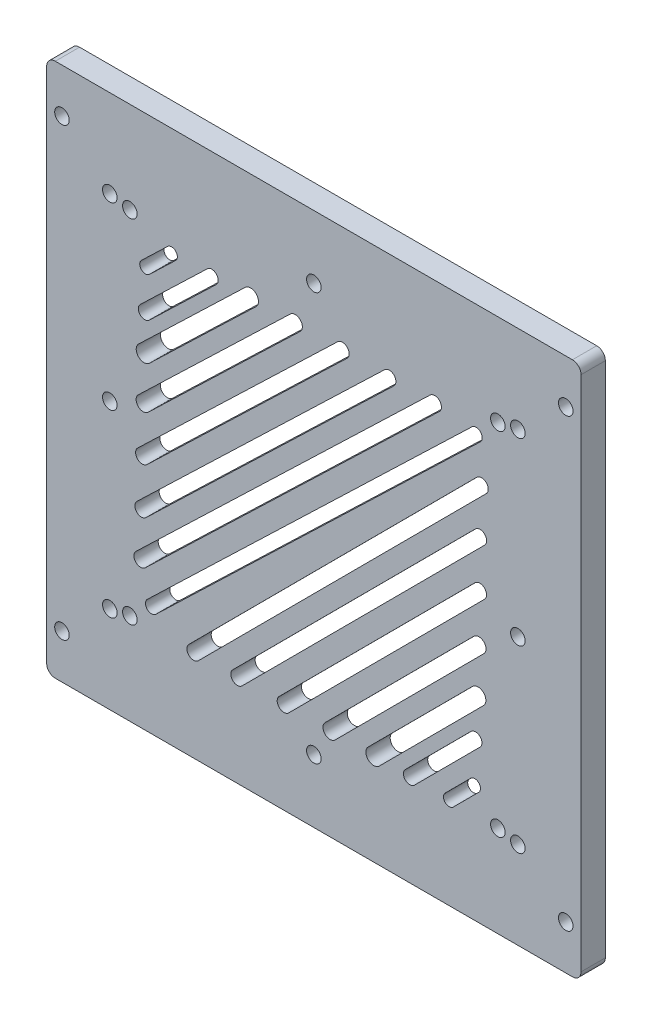
from build123d import *

# Parameters (mm, degrees)
BOSS_EXTRUDE1_DEPTH = 5
SKETCH1_3_R         = 1.5
CUT_EXTRUDE1_DEPTH  = 5
BOSS_EXTRUDE2_DEPTH = 1.5
SKETCH3_R           = 1.5
CUT_EXTRUDE3_DEPTH  = 10
CUT_EXTRUDE4_DEPTH  = 5


with BuildPart() as part:
    # Sketch1 → Boss-Extrude1 (new body)
    with BuildSketch(Plane.XY):
        with BuildLine():
            Line((1.77549062, 0), (108.22450938, 0))
            ThreePointArc((108.22450938, 0), (109.479970837, 0.520029163), (110, 1.77549062))
            Line((110, 1.77549062), (110, 108.22450938))
            ThreePointArc((110, 108.22450938), (109.479970837, 109.479970837), (108.22450938, 110))
            Line((108.22450938, 110), (1.77549062, 110))
            ThreePointArc((1.77549062, 110), (0.520029163, 109.479970837), (0, 108.22450938))
            Line((0, 108.22450938), (0, 1.77549062))
            ThreePointArc((0, 1.77549062), (0.520029163, 0.520029163), (1.77549062, 0))
        make_face()
    extrude(amount=BOSS_EXTRUDE1_DEPTH)

    # Sketch1<3> → Cut-Extrude1 (cut)
    with BuildSketch(Plane.XY):
        with Locations((3.15, 100.9)):
            Circle(SKETCH1_3_R)
        with Locations((13, 92)):
            Circle(SKETCH1_3_R)
        with Locations((106.85, 100.9)):
            Circle(SKETCH1_3_R)
        with Locations((97, 92)):
            Circle(SKETCH1_3_R)
        with Locations((3.15, 9.1)):
            Circle(SKETCH1_3_R)
        with Locations((13, 18)):
            Circle(SKETCH1_3_R)
        with Locations((106.85, 9.1)):
            Circle(SKETCH1_3_R)
        with Locations((97, 18)):
            Circle(SKETCH1_3_R)
        with Locations((17.125, 91.18)):
            Circle(SKETCH1_3_R)
        with Locations((92.875, 91.18)):
            Circle(SKETCH1_3_R)
        with Locations((17.125, 18.82)):
            Circle(SKETCH1_3_R)
        with Locations((92.875, 18.82)):
            Circle(SKETCH1_3_R)
    extrude(amount=CUT_EXTRUDE1_DEPTH, mode=Mode.SUBTRACT)

    # Sketch2 → Boss-Extrude2 (add)
    # profile 1 of 9: a face of its own
    with BuildSketch(Plane(origin=(0, 0, 0), x_dir=(-1, 0, 0), z_dir=(0, 0, -1))):
        Polygon((-66.436930188, 105.882940278), (-63.513853265, 105.882940278), (-63.513853265, 104.806017201), (-65.360007111, 104.806017201), (-65.360007111, 103.652171048), (-63.513853265, 103.652171048), (-63.513853265, 102.575247971), (-65.360007111, 102.575247971), (-65.360007111, 99.882940278), (-66.436930188, 99.882940278), align=None)
    # profile 2 of 9: a face of its own
    with BuildSketch(Plane(origin=(0, 0, 0), x_dir=(-1, 0, 0), z_dir=(0, 0, -1))):
        with BuildLine():
            Line((-62.436930188, 105.882940278), (-61.182122496, 105.882940278))
            add(Edge.make_bspline(
                [(-61.182122496, 105.882940278), (-61.099180089, 105.88264588), (-60.939658478, 105.88207967), (-60.709637027, 105.873146374), (-60.498330692, 105.860714958), (-60.305426613, 105.841744288), (-60.131007319, 105.816591473), (-59.974898001, 105.786940466), (-59.837103221, 105.753146786), (-59.716460871, 105.711037195), (-59.607587115, 105.663538215), (-59.506101639, 105.608961016), (-59.409765521, 105.547913333), (-59.319222665, 105.478788834), (-59.233686231, 105.402831055), (-59.152994851, 105.319963534), (-59.078288767, 105.22948359), (-59.010030564, 105.131962942), (-58.947818706, 105.029373456), (-58.892836472, 104.921574276), (-58.848124827, 104.808490436), (-58.808617296, 104.691756242), (-58.780161302, 104.569702954), (-58.760370574, 104.443518783), (-58.745880577, 104.312759547), (-58.745047472, 104.223927528), (-58.744622496, 104.178613355)],
                knots=[0, 0, 0, 0, 1.749336639, 3.364467119, 4.854658419, 6.213483162, 7.451590619, 8.570285859, 9.5643256, 10.440900261, 11.26203566, 12.067320669, 12.869050712, 13.665104639, 14.467235401, 15.27997916, 16.102287765, 16.939272006, 17.78853747, 18.631303466, 19.488103222, 20.351255419, 21.228522269, 22.127379805, 23.044756219, 24, 24, 24, 24], degree=3))
            add(Edge.make_bspline(
                [(-58.744622496, 104.178613355), (-58.745726431, 104.131315769), (-58.747891046, 104.038573823), (-58.759550844, 103.902343468), (-58.780861291, 103.772007794), (-58.813139063, 103.647948406), (-58.85023817, 103.528621242), (-58.899570466, 103.416227962), (-58.955246837, 103.309133969), (-59.021372037, 103.208854147), (-59.093941214, 103.113161083), (-59.178337639, 103.025721131), (-59.269093722, 102.941834726), (-59.371311192, 102.866756227), (-59.480484207, 102.795409098), (-59.598781922, 102.730749598), (-59.725432285, 102.671152338), (-59.814473762, 102.637916788), (-59.860007111, 102.620921048)],
                knots=[0, 0, 0, 0, 1.099860209, 2.156625411, 3.176576793, 4.16617041, 5.135385252, 6.078461593, 7.016046972, 7.938469504, 8.868247731, 9.803980173, 10.76021508, 11.73834243, 12.748633912, 13.790971185, 14.870363756, 16, 16, 16, 16], degree=3))
            Line((-59.860007111, 102.620921048), (-58.475391726, 99.882940278))
            Line((-58.475391726, 99.882940278), (-59.672507111, 99.882940278))
            Line((-59.672507111, 99.882940278), (-60.994622496, 102.498324894))
            Line((-60.994622496, 102.498324894), (-61.360007111, 102.498324894))
            Line((-61.360007111, 102.498324894), (-61.360007111, 99.882940278))
            Line((-61.360007111, 99.882940278), (-62.436930188, 99.882940278))
            Line((-62.436930188, 99.882940278), (-62.436930188, 105.882940278))
        make_face()
        with BuildLine():
            Line((-61.360007111, 103.575247971), (-60.940535957, 103.575247971))
            add(Edge.make_bspline(
                [(-60.940535957, 103.575247971), (-60.889252122, 103.575825564), (-60.791054596, 103.57693153), (-60.649833658, 103.582061461), (-60.521571366, 103.594422061), (-60.405716919, 103.610039216), (-60.301687349, 103.628071477), (-60.210410563, 103.653912802), (-60.130480124, 103.681602436), (-60.062843211, 103.716013468), (-60.005055786, 103.755146275), (-59.955160044, 103.799602116), (-59.913889111, 103.851054092), (-59.879921028, 103.908103959), (-59.853497552, 103.97125631), (-59.83421044, 104.039817875), (-59.823431796, 104.114569659), (-59.822191676, 104.166158567), (-59.821545572, 104.193036432)],
                knots=[0, 0, 0, 0, 1.688639943, 3.233382647, 4.650958383, 5.928841754, 7.082724185, 8.122798841, 9.049171256, 9.863274652, 10.613301712, 11.341792392, 12.054588806, 12.776240173, 13.521029143, 14.301969904, 15.115324896, 16, 16, 16, 16], degree=3))
            add(Edge.make_bspline(
                [(-59.821545572, 104.193036432), (-59.82276709, 104.224834908), (-59.825166535, 104.287297122), (-59.848976485, 104.377220809), (-59.886876782, 104.460451333), (-59.938827709, 104.536612638), (-60.004253147, 104.603380896), (-60.079334, 104.662237648), (-60.165690692, 104.708777163), (-60.24565049, 104.739474131), (-60.318395217, 104.757840444), (-60.384045038, 104.771526858), (-60.460067926, 104.781226813), (-60.546521274, 104.791515341), (-60.643184709, 104.798186931), (-60.750585106, 104.803055861), (-60.868414011, 104.80504798), (-60.950551948, 104.805684825), (-60.993420572, 104.806017201)],
                knots=[0, 0, 0, 0, 1.020303359, 2.004196876, 2.966617323, 3.9489082, 4.950758222, 5.960522915, 7.003732012, 8.091992268, 8.70421221, 9.413913587, 10.24622431, 11.166358409, 12.212345909, 13.359657661, 14.621978493, 16, 16, 16, 16], degree=3))
            Line((-60.993420572, 104.806017201), (-61.360007111, 104.806017201))
            Line((-61.360007111, 104.806017201), (-61.360007111, 103.575247971))
        make_face(mode=Mode.SUBTRACT)
    # profile 3 of 9: a face of its own
    with BuildSketch(Plane(origin=(0, 0, 0), x_dir=(-1, 0, 0), z_dir=(0, 0, -1))):
        with BuildLine():
            add(Edge.make_bspline(
                [(-54.771064803, 106.036786432), (-54.66674745, 106.034085469), (-54.460801367, 106.028753156), (-54.157928997, 105.984304167), (-53.866055468, 105.91188091), (-53.585312764, 105.811207346), (-53.316403832, 105.679556721), (-53.05838014, 105.520661418), (-52.812165918, 105.331522383), (-52.580284171, 105.116551918), (-52.365983617, 104.882780923), (-52.180292061, 104.631084886), (-52.021941114, 104.367985505), (-51.890699426, 104.092777795), (-51.790734452, 103.803555813), (-51.720584895, 103.501794209), (-51.67551728, 103.187578831), (-51.670333811, 102.973640986), (-51.667699419, 102.864911432)],
                knots=[0, 0, 0, 0, 1.014329547, 2.002516266, 2.970391464, 3.935626869, 4.897733899, 5.877609409, 6.878433252, 7.912639331, 8.949961323, 9.958554974, 10.949718813, 11.932905612, 12.9188844, 13.919928257, 14.942845884, 16, 16, 16, 16], degree=3))
            add(Edge.make_bspline(
                [(-51.667699419, 102.864911432), (-51.670504933, 102.757407009), (-51.676033289, 102.545566094), (-51.718745038, 102.234246335), (-51.790075922, 101.935717226), (-51.888345411, 101.649303041), (-52.017206872, 101.376391071), (-52.172469802, 101.115238813), (-52.358231297, 100.86826982), (-52.567715905, 100.635616627), (-52.798340278, 100.424433932), (-53.042608101, 100.238329547), (-53.299391495, 100.080631715), (-53.568314611, 99.951412667), (-53.849954142, 99.851130524), (-54.143614404, 99.780374184), (-54.449277226, 99.737374128), (-54.657142768, 99.731881883), (-54.762651342, 99.729094125)],
                knots=[0, 0, 0, 0, 1.051557043, 2.072126891, 3.067553643, 4.050577992, 5.02905126, 6.015227836, 7.017913613, 8.04756643, 9.074058332, 10.072836633, 11.047628519, 12.017157415, 12.98668631, 13.966869689, 14.968021931, 16, 16, 16, 16], degree=3))
            add(Edge.make_bspline(
                [(-54.762651342, 99.729094125), (-54.873000659, 99.731594881), (-55.089821985, 99.736508527), (-55.407140966, 99.783235051), (-55.711159968, 99.85362152), (-55.999325057, 99.958669549), (-56.274570948, 100.089988418), (-56.534875329, 100.251715478), (-56.780150719, 100.443583463), (-57.00899018, 100.660678563), (-57.216319286, 100.898228218), (-57.39932789, 101.149178363), (-57.553699707, 101.411611959), (-57.679440385, 101.685651831), (-57.778569285, 101.969594888), (-57.848493461, 102.265170425), (-57.88979934, 102.571669545), (-57.895553009, 102.779849873), (-57.898468649, 102.885344125)],
                knots=[0, 0, 0, 0, 1.067978421, 2.098431617, 3.099715153, 4.085208694, 5.062210972, 6.048429807, 7.046490867, 8.072918869, 9.098532598, 10.095778865, 11.076610158, 12.041847152, 13.011192615, 13.984257998, 14.978533688, 16, 16, 16, 16], degree=3))
            add(Edge.make_bspline(
                [(-57.898468649, 102.885344125), (-57.897553553, 102.956315134), (-57.895734949, 103.097358497), (-57.873827939, 103.306377562), (-57.842288143, 103.511316855), (-57.795642282, 103.71135928), (-57.738979482, 103.907916045), (-57.665564822, 104.099157549), (-57.58199907, 104.287126778), (-57.484360357, 104.46960358), (-57.37579555, 104.644909017), (-57.257341678, 104.81221614), (-57.128700893, 104.969501964), (-56.990287589, 105.117800105), (-56.841624774, 105.25613579), (-56.684667954, 105.386467352), (-56.516373082, 105.505332721), (-56.340423603, 105.615634827), (-56.157811481, 105.715379109), (-55.969280112, 105.800278459), (-55.778713615, 105.874419615), (-55.583566279, 105.932935093), (-55.385929454, 105.980595338), (-55.183691792, 106.012113876), (-54.978680394, 106.034020279), (-54.840434238, 106.035862193), (-54.771064803, 106.036786432)],
                knots=[0, 0, 0, 0, 1.034744296, 2.056386356, 3.06226378, 4.057406941, 5.050368692, 6.043467995, 7.042652155, 8.049140477, 9.059438543, 10.048523776, 11.036952808, 12.020949711, 13.004946614, 13.997082645, 14.994316842, 16.007702937, 17.024872941, 18.026463647, 19.021641123, 20.005082605, 20.995858141, 21.984425357, 22.988620895, 24, 24, 24, 24], degree=3))
        make_face()
        with BuildLine():
            add(Edge.make_bspline(
                [(-54.787891726, 104.959863355), (-54.858097291, 104.957979582), (-54.996654983, 104.954261768), (-55.199893883, 104.925937054), (-55.395010404, 104.880699267), (-55.580922939, 104.815172884), (-55.758437249, 104.731774429), (-55.92786801, 104.630795307), (-56.086868958, 104.508764473), (-56.237560217, 104.372233219), (-56.373684973, 104.220106025), (-56.493955489, 104.057075864), (-56.594602539, 103.883414995), (-56.678895074, 103.700736685), (-56.742348671, 103.506986766), (-56.787544765, 103.303682902), (-56.81610701, 103.09047479), (-56.819707316, 102.945131097), (-56.821545572, 102.870921048)],
                knots=[0, 0, 0, 0, 1.033739768, 2.040188636, 3.016340934, 3.979330865, 4.937572243, 5.900995986, 6.878200029, 7.884839167, 8.891893314, 9.879764717, 10.863503415, 11.843163062, 12.837761627, 13.859916423, 14.907309254, 16, 16, 16, 16], degree=3))
            add(Edge.make_bspline(
                [(-56.821545572, 102.870921048), (-56.819108326, 102.78867962), (-56.814331726, 102.627500047), (-56.780722987, 102.39237563), (-56.723221782, 102.170323954), (-56.640191158, 101.96243104), (-56.537211402, 101.766388395), (-56.409326889, 101.584598798), (-56.258608743, 101.415973779), (-56.142496704, 101.317523469), (-56.083564803, 101.267555663)],
                knots=[0, 0, 0, 0, 1.078454662, 2.113592447, 3.107694534, 4.079536787, 5.043276885, 6.005368276, 6.987637804, 8, 8, 8, 8], degree=3))
            add(Edge.make_bspline(
                [(-56.083564803, 101.267555663), (-56.035288326, 101.230641367), (-55.939823048, 101.15764446), (-55.78743968, 101.064083948), (-55.630514817, 100.983893257), (-55.467864264, 100.919100127), (-55.29983153, 100.86813494), (-55.126439659, 100.832444858), (-54.94793433, 100.810046244), (-54.827220661, 100.807369186), (-54.766257111, 100.806017201)],
                knots=[0, 0, 0, 0, 1.023928204, 2.024787132, 3.009472467, 3.9914905, 4.972207045, 5.96565515, 6.972602802, 8, 8, 8, 8], degree=3))
            add(Edge.make_bspline(
                [(-54.766257111, 100.806017201), (-54.697258732, 100.807916947), (-54.561502252, 100.811654755), (-54.362046754, 100.839630776), (-54.170962329, 100.886976305), (-53.987062709, 100.951927867), (-53.810878177, 101.036373461), (-53.643269796, 101.140484639), (-53.483943703, 101.262983049), (-53.333444423, 101.401307258), (-53.195880967, 101.554033728), (-53.075861431, 101.717933474), (-52.972014308, 101.889395296), (-52.889474637, 102.070845973), (-52.823514132, 102.260572698), (-52.778861996, 102.459415728), (-52.750058465, 102.666555358), (-52.746457144, 102.807521196), (-52.744622496, 102.879334509)],
                knots=[0, 0, 0, 0, 1.026359118, 2.019393844, 2.989460624, 3.950973911, 4.916101784, 5.890408035, 6.881132271, 7.902007068, 8.92769091, 9.933912415, 10.920395702, 11.90457117, 12.894218921, 13.903490204, 14.931958862, 16, 16, 16, 16], degree=3))
            add(Edge.make_bspline(
                [(-52.744622496, 102.879334509), (-52.746520623, 102.950734876), (-52.750256798, 103.091275608), (-52.778282059, 103.297882684), (-52.825327334, 103.49584788), (-52.890473939, 103.685494497), (-52.973662704, 103.867008457), (-53.07653405, 104.03975145), (-53.198727016, 104.203556476), (-53.337429338, 104.357307267), (-53.488398291, 104.498594395), (-53.650478546, 104.621205939), (-53.819134916, 104.727751472), (-53.998237201, 104.81121494), (-54.184121119, 104.877710109), (-54.377920943, 104.926678105), (-54.580370701, 104.954062786), (-54.718101458, 104.957912597), (-54.787891726, 104.959863355)],
                knots=[0, 0, 0, 0, 1.055025985, 2.07665775, 3.074803781, 4.057872707, 5.035505728, 6.020516407, 7.023567878, 8.050795229, 9.077271434, 10.074415901, 11.050397877, 12.019801805, 12.988065821, 13.964604439, 14.968634123, 16, 16, 16, 16], degree=3))
        make_face(mode=Mode.SUBTRACT)
    # profile 4 of 9: a face of its own
    with BuildSketch(Plane(origin=(0, 0, 0), x_dir=(-1, 0, 0), z_dir=(0, 0, -1))):
        Polygon((-50.590776342, 105.882940278), (-49.620824419, 105.882940278), (-46.898468649, 101.934622971), (-46.898468649, 105.882940278), (-45.821545572, 105.882940278), (-45.821545572, 99.882940278), (-46.798709034, 99.882940278), (-49.513853265, 103.819238355), (-49.513853265, 99.882940278), (-50.590776342, 99.882940278), align=None)
    # profile 5 of 9: a face of its own
    with BuildSketch(Plane(origin=(0, 0, 0), x_dir=(-1, 0, 0), z_dir=(0, 0, -1))):
        Polygon((-45.052314803, 105.882940278), (-41.821545572, 105.882940278), (-41.821545572, 104.806017201), (-42.898468649, 104.806017201), (-42.898468649, 99.882940278), (-43.975391726, 99.882940278), (-43.975391726, 104.806017201), (-45.052314803, 104.806017201), align=None)
    # profile 6 of 9: a face of its own
    with BuildSketch(Plane(origin=(0, 0, 0), x_dir=(-1, 0, 0), z_dir=(0, 0, -1))):
        with BuildLine():
            Line((-63.995656629, 4.312530955), (-63.995656629, 10.312530955))
            Line((-63.995656629, 10.312530955), (-63.034118168, 10.312530955))
            add(Edge.make_bspline(
                [(-63.034118168, 10.312530955), (-62.966804463, 10.312538637), (-62.836553721, 10.312553502), (-62.648635892, 10.305954445), (-62.474357977, 10.297417825), (-62.314274593, 10.287867332), (-62.16811327, 10.271409926), (-62.036096268, 10.254065617), (-61.917959817, 10.23314945), (-61.844922469, 10.214387), (-61.810560475, 10.205559801)],
                knots=[0, 0, 0, 0, 1.311965854, 2.538629056, 3.664479157, 4.713267157, 5.663616078, 6.530575999, 7.308677837, 8, 8, 8, 8], degree=3))
            add(Edge.make_bspline(
                [(-61.810560475, 10.205559801), (-61.76543969, 10.19310888), (-61.676898223, 10.168676176), (-61.550078586, 10.119333274), (-61.429772471, 10.06448514), (-61.316126767, 10.001913678), (-61.209839305, 9.930863474), (-61.111314012, 9.850770653), (-61.018425942, 9.764850137), (-60.934473339, 9.670707345), (-60.858594018, 9.571228047), (-60.792668492, 9.466438308), (-60.73538766, 9.357940433), (-60.689547991, 9.244369047), (-60.655008661, 9.126247178), (-60.629746739, 9.004079223), (-60.613373593, 8.877478615), (-60.611826546, 8.791348082), (-60.611041245, 8.747627109)],
                knots=[0, 0, 0, 0, 1.099996261, 2.158545794, 3.195537121, 4.207578794, 5.205712374, 6.197378256, 7.190519799, 8.17788031, 9.159561366, 10.129234751, 11.085776129, 12.040971148, 13.00380137, 13.975669004, 14.972423361, 16, 16, 16, 16], degree=3))
            add(Edge.make_bspline(
                [(-60.611041245, 8.747627109), (-60.613094574, 8.691457133), (-60.617136302, 8.580893438), (-60.642955132, 8.418495373), (-60.691369461, 8.26500586), (-60.754718433, 8.117596145), (-60.840853229, 7.976816066), (-60.950227762, 7.842732562), (-61.081070522, 7.711216999), (-61.181434142, 7.632382291), (-61.233637398, 7.591377109)],
                knots=[0, 0, 0, 0, 0.986156485, 1.941127874, 2.875419072, 3.804401753, 4.751181392, 5.761612777, 6.835722519, 8, 8, 8, 8], degree=3))
            add(Edge.make_bspline(
                [(-61.233637398, 7.591377109), (-61.191334384, 7.569781786), (-61.108389876, 7.527439334), (-60.990633042, 7.457840983), (-60.881603068, 7.38381431), (-60.780811097, 7.30684876), (-60.690371355, 7.223681654), (-60.606549433, 7.139105194), (-60.533480671, 7.0482735), (-60.468140382, 6.954423987), (-60.411347665, 6.856197704), (-60.36188747, 6.753760532), (-60.320110218, 6.646762523), (-60.284732161, 6.535748211), (-60.258347196, 6.420335759), (-60.241143638, 6.30048389), (-60.227971519, 6.17660136), (-60.226946852, 6.092215674), (-60.22642586, 6.049309801)],
                knots=[0, 0, 0, 0, 1.164658916, 2.283573913, 3.35186032, 4.395461096, 5.390182219, 6.362969632, 7.312859996, 8.245001507, 9.165155236, 10.092416118, 11.032087915, 11.979892451, 12.947605196, 13.931445124, 14.948243989, 16, 16, 16, 16], degree=3))
            add(Edge.make_bspline(
                [(-60.22642586, 6.049309801), (-60.229806747, 5.967362037), (-60.236478915, 5.805638454), (-60.285262551, 5.568191091), (-60.369837874, 5.343069455), (-60.483405093, 5.131168275), (-60.623341758, 4.938621743), (-60.784228793, 4.769952652), (-60.964446435, 4.627178011), (-61.130718992, 4.530816205), (-61.274531659, 4.466148421), (-61.393649005, 4.42616672), (-61.521578509, 4.389127732), (-61.660663534, 4.36311819), (-61.808382656, 4.339311397), (-61.966176147, 4.32461259), (-62.133749095, 4.31465157), (-62.248845438, 4.313252118), (-62.308156629, 4.312530955)],
                knots=[0, 0, 0, 0, 1.284142165, 2.534249414, 3.780121997, 5.041676246, 6.291546858, 7.49970053, 8.684500223, 9.883330709, 10.50184324, 11.153274765, 11.851151195, 12.587658647, 13.369265475, 14.195992086, 15.070362669, 16, 16, 16, 16], degree=3))
            Line((-62.308156629, 4.312530955), (-63.995656629, 4.312530955))
        make_face()
        with BuildLine():
            Line((-62.918733552, 9.235607878), (-62.918733552, 7.92791557))
            Line((-62.918733552, 7.92791557), (-62.63267586, 7.92791557))
            add(Edge.make_bspline(
                [(-62.63267586, 7.92791557), (-62.593798049, 7.928254599), (-62.518746789, 7.928909075), (-62.410343205, 7.937338491), (-62.309545377, 7.951719597), (-62.216735612, 7.971784859), (-62.131049352, 7.997264816), (-62.053033986, 8.027922691), (-61.983032532, 8.065328632), (-61.901707034, 8.12104643), (-61.815740118, 8.203037666), (-61.740064409, 8.321490993), (-61.695491921, 8.457711869), (-61.690527748, 8.553785379), (-61.687964322, 8.603396339)],
                knots=[0, 0, 0, 0, 1.065314748, 2.056525647, 2.977365736, 3.853934255, 4.656397591, 5.425096493, 6.14721249, 6.826394842, 8.123232004, 9.372140726, 10.643011755, 12, 12, 12, 12], degree=3))
            add(Edge.make_bspline(
                [(-61.687964322, 8.603396339), (-61.690015532, 8.649865247), (-61.693981465, 8.739711012), (-61.738860229, 8.865862468), (-61.808565823, 8.977658476), (-61.890863073, 9.054173701), (-61.968361926, 9.106431344), (-62.034721199, 9.140840776), (-62.107555485, 9.171643748), (-62.188274776, 9.195196452), (-62.276418122, 9.212869571), (-62.371557361, 9.225848361), (-62.473856641, 9.234682277), (-62.544514971, 9.235292726), (-62.580993168, 9.235607878)],
                knots=[0, 0, 0, 0, 1.347982417, 2.606269829, 3.849316587, 5.153353503, 5.842674298, 6.568177932, 7.326619318, 8.142485038, 9.012069166, 9.942760135, 10.937925643, 12, 12, 12, 12], degree=3))
            Line((-62.580993168, 9.235607878), (-62.918733552, 9.235607878))
        make_face(mode=Mode.SUBTRACT)
        with BuildLine():
            Line((-62.918733552, 6.92791557), (-62.918733552, 5.389454032))
            Line((-62.918733552, 5.389454032), (-62.608637398, 5.389454032))
            add(Edge.make_bspline(
                [(-62.608637398, 5.389454032), (-62.547330994, 5.389804273), (-62.429461781, 5.390477655), (-62.260614343, 5.398613716), (-62.10708981, 5.413277533), (-61.969294964, 5.431584127), (-61.847018746, 5.456386698), (-61.740674479, 5.487919989), (-61.648803789, 5.522612101), (-61.571957538, 5.565460978), (-61.509178554, 5.615326446), (-61.452527102, 5.666290152), (-61.406337038, 5.725081601), (-61.369790598, 5.789177041), (-61.338159719, 5.856984293), (-61.319082206, 5.931151206), (-61.304557257, 6.009479652), (-61.30375791, 6.063657744), (-61.303348937, 6.091377109)],
                knots=[0, 0, 0, 0, 1.753078804, 3.370512758, 4.83203934, 6.162291463, 7.344201807, 8.395507345, 9.331626367, 10.147333109, 10.898971645, 11.62040215, 12.321813352, 13.025280112, 13.727906689, 14.453419512, 15.208716525, 16, 16, 16, 16], degree=3))
            add(Edge.make_bspline(
                [(-61.303348937, 6.091377109), (-61.30425084, 6.123074638), (-61.306007505, 6.184812899), (-61.320354208, 6.275049956), (-61.346426854, 6.359292236), (-61.379266623, 6.439693928), (-61.424964907, 6.513376371), (-61.479275755, 6.582889434), (-61.544897125, 6.645879192), (-61.618692184, 6.7061555), (-61.704766814, 6.758930673), (-61.803161399, 6.804722484), (-61.914410472, 6.842966118), (-62.038858638, 6.873415725), (-62.175960326, 6.899257885), (-62.326716229, 6.914688507), (-62.489870799, 6.926164939), (-62.603004833, 6.927318767), (-62.661522014, 6.92791557)],
                knots=[0, 0, 0, 0, 0.845221588, 1.646264278, 2.427170338, 3.19324141, 3.95557735, 4.731569926, 5.540061037, 6.376114724, 7.268642756, 8.224665384, 9.265483498, 10.400594375, 11.639216012, 12.983232105, 14.439614077, 16, 16, 16, 16], degree=3))
            Line((-62.661522014, 6.92791557), (-62.918733552, 6.92791557))
        make_face(mode=Mode.SUBTRACT)
    # profile 7 of 9: a face of its own
    with BuildSketch(Plane(origin=(0, 0, 0), x_dir=(-1, 0, 0), z_dir=(0, 0, -1))):
        Polygon((-57.302147014, 10.312530955), (-56.303348937, 10.312530955), (-53.880272014, 4.312530955), (-55.030512398, 4.312530955), (-55.496858552, 5.543300186), (-58.111041245, 5.543300186), (-58.577387398, 4.312530955), (-59.72642586, 4.312530955), align=None)
        Polygon((-56.803348937, 8.703155955), (-57.702387398, 6.620223262), (-55.904310475, 6.620223262), align=None, mode=Mode.SUBTRACT)
    # profile 8 of 9: a face of its own
    with BuildSketch(Plane(origin=(0, 0, 0), x_dir=(-1, 0, 0), z_dir=(0, 0, -1))):
        with BuildLine():
            Line((-47.611041245, 9.27166557), (-48.400704706, 8.516857878))
            add(Edge.make_bspline(
                [(-48.400704706, 8.516857878), (-48.467690394, 8.586121192), (-48.598534429, 8.721414143), (-48.809373409, 8.900530087), (-49.028638271, 9.049798991), (-49.252063656, 9.175512312), (-49.483668338, 9.270623399), (-49.720774336, 9.33993245), (-49.964895642, 9.382187559), (-50.130107553, 9.387022291), (-50.213204706, 9.389454032)],
                knots=[0, 0, 0, 0, 1.115251505, 2.178435587, 3.19620269, 4.182487026, 5.141301733, 6.088180966, 7.038406374, 8, 8, 8, 8], degree=3))
            add(Edge.make_bspline(
                [(-50.213204706, 9.389454032), (-50.282600928, 9.387532872), (-50.419546725, 9.383741674), (-50.620619042, 9.355948457), (-50.812955105, 9.308684881), (-50.99721331, 9.243546919), (-51.172851471, 9.159261852), (-51.340237834, 9.055894917), (-51.498959715, 8.934379663), (-51.646920489, 8.795344815), (-51.782269806, 8.643438796), (-51.901859546, 8.481355436), (-52.002035136, 8.309466059), (-52.084247614, 8.129511435), (-52.148287955, 7.940658643), (-52.194020805, 7.743034828), (-52.220471464, 7.536404635), (-52.224419402, 7.395938969), (-52.22642586, 7.324550186)],
                knots=[0, 0, 0, 0, 1.035432265, 2.043311493, 3.022114605, 3.98653278, 4.95457646, 5.923598177, 6.917315552, 7.932509744, 8.948865224, 9.949768934, 10.933144597, 11.912367597, 12.897413939, 13.903909035, 14.934704909, 16, 16, 16, 16], degree=3))
            add(Edge.make_bspline(
                [(-52.22642586, 7.324550186), (-52.225847622, 7.274444542), (-52.224707902, 7.17568529), (-52.212231654, 7.029592946), (-52.192141953, 6.887848835), (-52.163067178, 6.750667661), (-52.126708886, 6.617930541), (-52.084052331, 6.48849236), (-52.03054031, 6.364141661), (-51.97114116, 6.243434192), (-51.902060632, 6.129663606), (-51.82757908, 6.021173911), (-51.746815997, 5.918496912), (-51.659248276, 5.822052355), (-51.56364351, 5.733347453), (-51.462472728, 5.649714744), (-51.354029321, 5.573247838), (-51.240565931, 5.502027714), (-51.121102379, 5.440158186), (-50.998879988, 5.384116347), (-50.87204562, 5.338602041), (-50.74214356, 5.301913358), (-50.609638031, 5.270715113), (-50.473233007, 5.251505394), (-50.334110949, 5.236958099), (-50.240087789, 5.236059889), (-50.192772014, 5.235607878)],
                knots=[0, 0, 0, 0, 1.103660481, 2.175337485, 3.227646561, 4.255952547, 5.262355991, 6.258840057, 7.255597736, 8.242457506, 9.22035537, 10.185017736, 11.140346927, 12.096287581, 13.051739095, 14.01125915, 14.986044842, 15.97314143, 16.960198552, 17.947847494, 18.933482797, 19.925264591, 20.920966487, 21.929612487, 22.958107872, 24, 24, 24, 24], degree=3))
            add(Edge.make_bspline(
                [(-50.192772014, 5.235607878), (-50.112516328, 5.237929298), (-49.954834774, 5.242490285), (-49.723414421, 5.27815656), (-49.50289388, 5.336825564), (-49.326699023, 5.406110249), (-49.188655007, 5.474529774), (-49.083564138, 5.537814466), (-48.974891989, 5.608605342), (-48.86444351, 5.689574126), (-48.750976377, 5.779749162), (-48.636493545, 5.881105449), (-48.518064234, 5.990305472), (-48.440482366, 6.068243673), (-48.400704706, 6.108204032)],
                knots=[0, 0, 0, 0, 1.404581149, 2.759636711, 4.088442092, 5.392261763, 6.066678138, 6.783632037, 7.538459478, 8.336747902, 9.180226004, 10.074962426, 11.012997595, 12, 12, 12, 12], degree=3))
            Line((-48.400704706, 6.108204032), (-47.635079706, 5.304117493))
            add(Edge.make_bspline(
                [(-47.635079706, 5.304117493), (-47.688899023, 5.252156633), (-47.793942819, 5.150740145), (-47.952398469, 5.006738197), (-48.110654697, 4.877336438), (-48.264888361, 4.757838153), (-48.41762597, 4.651724615), (-48.568851326, 4.558889849), (-48.716852492, 4.476985929), (-48.86470276, 4.407394124), (-49.013322131, 4.348303454), (-49.166233998, 4.297430266), (-49.323905827, 4.254393379), (-49.487300607, 4.219668263), (-49.65489429, 4.191823408), (-49.82825533, 4.173028292), (-50.006284533, 4.16039296), (-50.1270445, 4.159257571), (-50.187964322, 4.158684801)],
                knots=[0, 0, 0, 0, 1.244526981, 2.429050516, 3.560637417, 4.644440555, 5.67424972, 6.652764056, 7.595344123, 8.486817594, 9.369275933, 10.254498637, 11.166417451, 12.086725134, 13.032340136, 13.991389299, 14.986715468, 16, 16, 16, 16], degree=3))
            add(Edge.make_bspline(
                [(-50.187964322, 4.158684801), (-50.299866488, 4.16153741), (-50.518827924, 4.167119174), (-50.839710198, 4.208476263), (-51.144539745, 4.277810695), (-51.434058158, 4.375868706), (-51.708173376, 4.501133219), (-51.966815274, 4.654701631), (-52.209566977, 4.836165933), (-52.43446753, 5.043399188), (-52.637900783, 5.272270922), (-52.817712221, 5.518016375), (-52.966452248, 5.781843296), (-53.089954298, 6.05985412), (-53.186531277, 6.353317516), (-53.254505098, 6.662550925), (-53.296424057, 6.98725576), (-53.30101005, 7.209036648), (-53.303348937, 7.322146339)],
                knots=[0, 0, 0, 0, 1.078019885, 2.10938526, 3.111377082, 4.085535484, 5.04941344, 6.010039228, 6.978205633, 7.964457913, 8.951525778, 9.924444315, 10.892603023, 11.863865945, 12.85144698, 13.863884204, 14.910567087, 16, 16, 16, 16], degree=3))
            add(Edge.make_bspline(
                [(-53.303348937, 7.322146339), (-53.302360637, 7.395915515), (-53.300402068, 7.542107992), (-53.279817324, 7.757461354), (-53.251120993, 7.967392361), (-53.205596875, 8.169721234), (-53.15072204, 8.367173715), (-53.082477973, 8.557603728), (-53.00097367, 8.741558586), (-52.908836205, 8.919346241), (-52.804602013, 9.089801994), (-52.688160978, 9.251461362), (-52.562510745, 9.405572324), (-52.424632146, 9.550090313), (-52.276528735, 9.686284224), (-52.117531845, 9.813415997), (-51.94859776, 9.933308846), (-51.76926924, 10.042871023), (-51.583030161, 10.141975836), (-51.392229485, 10.229390514), (-51.19733599, 10.302449054), (-50.999173702, 10.363048419), (-50.796905388, 10.408281559), (-50.591974788, 10.442521587), (-50.382638189, 10.461661982), (-50.242086798, 10.464795387), (-50.171137398, 10.466377109)],
                knots=[0, 0, 0, 0, 1.071919942, 2.124283339, 3.142214191, 4.149696895, 5.136002878, 6.119640489, 7.086990633, 8.058538607, 9.028339693, 9.988281803, 10.952401235, 11.916291999, 12.888973767, 13.874849856, 14.873389453, 15.898127285, 16.927174885, 17.938320013, 18.946391617, 19.950418109, 20.947802303, 21.956882652, 22.968648068, 24, 24, 24, 24], degree=3))
            add(Edge.make_bspline(
                [(-50.171137398, 10.466377109), (-50.110610286, 10.465470426), (-49.990185375, 10.463666489), (-49.810852474, 10.448628705), (-49.632953793, 10.425012018), (-49.457126265, 10.389379466), (-49.282112191, 10.347079125), (-49.110211453, 10.291692662), (-48.938712222, 10.229954012), (-48.770304211, 10.156158062), (-48.604752345, 10.075603117), (-48.445934939, 9.984210606), (-48.291185462, 9.887604723), (-48.143933071, 9.780067908), (-48.00141941, 9.665500721), (-47.864389697, 9.543368642), (-47.734046446, 9.411635371), (-47.652250259, 9.318558039), (-47.611041245, 9.27166557)],
                knots=[0, 0, 0, 0, 0.996412454, 1.982464992, 2.961075852, 3.949442424, 4.934965278, 5.923860011, 6.921385422, 7.934793307, 8.949617135, 9.951082467, 10.950285876, 11.951772932, 12.951063433, 13.960125323, 14.972308753, 16, 16, 16, 16], degree=3))
        make_face()
    # profile 9 of 9: a face of its own
    with BuildSketch(Plane(origin=(0, 0, 0), x_dir=(-1, 0, 0), z_dir=(0, 0, -1))):
        Polygon((-46.534118168, 10.312530955), (-45.457195091, 10.312530955), (-45.457195091, 8.200752109), (-43.755272014, 10.312530955), (-42.395897014, 10.312530955), (-44.534118168, 7.658684801), (-42.187964322, 4.312530955), (-43.484839322, 4.312530955), (-45.457195091, 7.126232878), (-45.457195091, 4.312530955), (-46.534118168, 4.312530955), align=None)
    extrude(amount=BOSS_EXTRUDE2_DEPTH)

    # Sketch3 → Cut-Extrude3 (cut)
    with BuildSketch(Plane.XY.offset(5)):
        with Locations((55, 97)):
            Circle(SKETCH3_R)
        with Locations((97, 55)):
            Circle(SKETCH3_R)
        with Locations((13, 55)):
            Circle(SKETCH3_R)
        with Locations((55, 13)):
            Circle(SKETCH3_R)
    extrude(amount=-CUT_EXTRUDE3_DEPTH, mode=Mode.SUBTRACT)

    # Sketch5 → Cut-Extrude4 (cut)
    with BuildSketch(Plane(origin=(0, 0, 0), x_dir=(-1, 0, 0), z_dir=(0, 0, -1))):
        with BuildLine():
            Line((-87.542828833, 87.703233797), (-20.721772636, 23.543812962))
            ThreePointArc((-20.721772636, 23.543812962), (-20.685776378, 21.772418174), (-22.457171167, 21.736421916))
            Line((-22.457171167, 21.736421916), (-89.278227364, 85.895842751))
            ThreePointArc((-89.278227364, 85.895842751), (-89.314223622, 87.66723754), (-87.542828833, 87.703233797))
        make_face()
        with BuildLine():
            Line((-78.930803717, 89.065297873), (-18.385265907, 30.931427188))
            ThreePointArc((-18.385265907, 30.931427188), (-18.34572193, 28.985447256), (-20.291701861, 28.945903279))
            Line((-20.291701861, 28.945903279), (-80.837239671, 87.079773964))
            ThreePointArc((-80.837239671, 87.079773964), (-80.876783648, 89.025753896), (-78.930803717, 89.065297873))
        make_face()
        with BuildLine():
            Line((-69.589509562, 88.921951616), (-18.569731734, 39.934408125))
            ThreePointArc((-18.569731734, 39.934408125), (-18.530733995, 38.015308864), (-20.449833256, 37.976311125))
            Line((-20.449833256, 37.976311125), (-71.469611084, 86.963854616))
            ThreePointArc((-71.469611084, 86.963854616), (-71.508608823, 88.882953877), (-69.589509562, 88.921951616))
        make_face()
        with BuildLine():
            Line((-59.918793441, 89.072824473), (-18.731150491, 49.525779459))
            ThreePointArc((-18.731150491, 49.525779459), (-18.691306712, 47.56504613), (-20.652040041, 47.525202352))
            Line((-20.652040041, 47.525202352), (-61.839682991, 87.072247365))
            ThreePointArc((-61.839682991, 87.072247365), (-61.87952677, 89.032980694), (-59.918793441, 89.072824473))
        make_face()
        with BuildLine():
            Line((-50.159504009, 89.125895283), (-18.86057571, 59.07367482))
            ThreePointArc((-18.86057571, 59.07367482), (-18.818618, 57.008913802), (-20.883379018, 56.966956091))
            Line((-20.883379018, 56.966956091), (-52.182307317, 87.019176554))
            ThreePointArc((-52.182307317, 87.019176554), (-52.224265028, 89.083937573), (-50.159504009, 89.125895283))
        make_face()
        with BuildLine():
            Line((-40.871931134, 89.232406628), (-18.928971117, 68.16348485))
            ThreePointArc((-18.928971117, 68.16348485), (-18.882770816, 65.889943733), (-21.156311934, 65.843743432))
            Line((-21.156311934, 65.843743432), (-43.099271951, 86.91266521))
            ThreePointArc((-43.099271951, 86.91266521), (-43.145472252, 89.186206327), (-40.871931134, 89.232406628))
        make_face()
        with BuildLine():
            Line((-33.087129892, 88.653974063), (-19.270998609, 75.388170861))
            ThreePointArc((-19.270998609, 75.388170861), (-19.233128452, 73.524560487), (-21.096738826, 73.48669033))
            Line((-21.096738826, 73.48669033), (-34.912870108, 86.752493532))
            ThreePointArc((-34.912870108, 86.752493532), (-34.950740266, 88.616103906), (-33.087129892, 88.653974063))
        make_face()
        with BuildLine():
            Line((-24.908061923, 88.551600865), (-19.519995022, 83.378152981))
            ThreePointArc((-19.519995022, 83.378152981), (-19.486202623, 81.715211245), (-21.149144359, 81.681418846))
            Line((-21.149144359, 81.681418846), (-26.53721126, 86.85486673))
            ThreePointArc((-26.53721126, 86.85486673), (-26.571003659, 88.517808466), (-24.908061923, 88.551600865))
        make_face()
        with BuildLine():
            Line((-88.956076264, 23.275249133), (-83.681218033, 17.98642142))
            ThreePointArc((-83.681218033, 17.98642142), (-82.017934442, 17.984221884), (-82.015734905, 19.647505475))
            Line((-82.015734905, 19.647505475), (-87.290593136, 24.936333188))
            ThreePointArc((-87.290593136, 24.936333188), (-88.953876728, 24.938532724), (-88.956076264, 23.275249133))
        make_face()
        with BuildLine():
            Line((-89.213788394, 31.450896971), (-75.687947836, 17.889235738))
            ThreePointArc((-75.687947836, 17.889235738), (-73.823954355, 17.886770781), (-73.821489399, 19.750764262))
            Line((-73.821489399, 19.750764262), (-87.347329957, 33.312425496))
            ThreePointArc((-87.347329957, 33.312425496), (-89.211323438, 33.314890452), (-89.213788394, 31.450896971))
        make_face()
        with BuildLine():
            Line((-89.939985101, 39.223306697), (-68.458068601, 17.684499334))
            ThreePointArc((-68.458068601, 17.684499334), (-66.184060105, 17.681492171), (-66.181052943, 19.955500666))
            Line((-66.181052943, 19.955500666), (-87.662969443, 41.49430803))
            ThreePointArc((-87.662969443, 41.49430803), (-89.936977938, 41.497315193), (-89.939985101, 39.223306697))
        make_face()
        with BuildLine():
            Line((-90.009905883, 48.511227114), (-59.368599344, 17.788772768))
            ThreePointArc((-59.368599344, 17.788772768), (-57.303413867, 17.786041755), (-57.300682853, 19.851227232))
            Line((-57.300682853, 19.851227232), (-87.941989393, 50.573681577))
            ThreePointArc((-87.941989393, 50.573681577), (-90.007174869, 50.576412591), (-90.009905883, 48.511227114))
        make_face()
        with BuildLine():
            Line((-90.142217584, 58.269763907), (-49.819968169, 17.840728508))
            ThreePointArc((-49.819968169, 17.840728508), (-47.858831767, 17.83813509), (-47.856238349, 19.799271492))
            Line((-47.856238349, 19.799271492), (-88.178487763, 60.228306891))
            ThreePointArc((-88.178487763, 60.228306891), (-90.139624165, 60.230900309), (-90.142217584, 58.269763907))
        make_face()
        with BuildLine():
            Line((-90.175062477, 67.94160107), (-40.227261163, 17.861522287))
            ThreePointArc((-40.227261163, 17.861522287), (-38.307767388, 17.858983937), (-38.305229037, 19.778477713))
            Line((-38.305229037, 19.778477713), (-88.253030351, 69.858556496))
            ThreePointArc((-88.253030351, 69.858556496), (-90.172524127, 69.861094846), (-90.175062477, 67.94160107))
        make_face()
        with BuildLine():
            Line((-90.495816192, 77.278487151), (-31.222400634, 17.848096966))
            ThreePointArc((-31.222400634, 17.848096966), (-29.276020662, 17.845523062), (-29.273446757, 19.791903034))
            Line((-29.273446757, 19.791903034), (-88.546862316, 79.222293219))
            ThreePointArc((-88.546862316, 79.222293219), (-90.493242288, 79.224867123), (-90.495816192, 77.278487151))
        make_face()
    extrude(amount=-CUT_EXTRUDE4_DEPTH, mode=Mode.SUBTRACT)


solid = part.part
